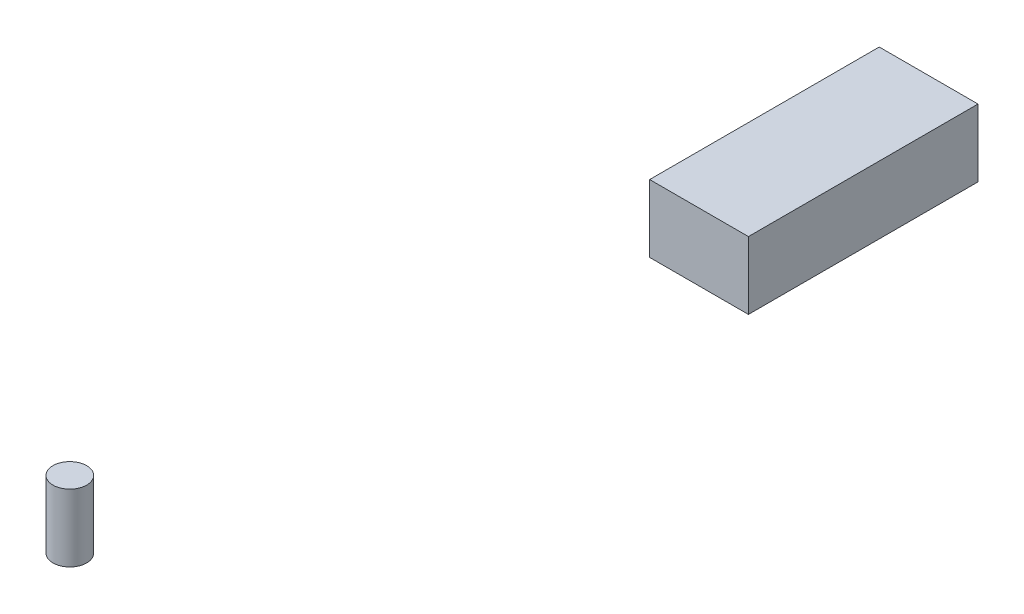
from build123d import *

# Parameters (mm, degrees)
CROQUIS1_R              = 2.5
SALIENTE_EXTRUIR1_DEPTH = 10
CROQUIS2_W              = 14.641519207
CROQUIS2_H              = 34.034323056
SALIENTE_EXTRUIR2_DEPTH = 10


with BuildPart() as part:
    # Croquis1 → Saliente-Extruir1 (new body)
    with BuildSketch(Plane(origin=(0, 0, 0), x_dir=(1, 0, 0), z_dir=(0, 1, 0))):
        with Locations(Location((0, 0, 0), (0, 0, 270))):
            Circle(CROQUIS1_R)
    extrude(amount=SALIENTE_EXTRUIR1_DEPTH)


with BuildPart() as body_2:
    # Croquis2 → Saliente-Extruir2 (new body)
    with BuildSketch(Plane(origin=(0, 0, 0), x_dir=(1, 0, 0), z_dir=(0, 1, 0))):
        with Locations((12.320759604, 97.977842763)):
            Rectangle(CROQUIS2_W, CROQUIS2_H)
    extrude(amount=SALIENTE_EXTRUIR2_DEPTH)


solid = Compound([part.part, body_2.part])
